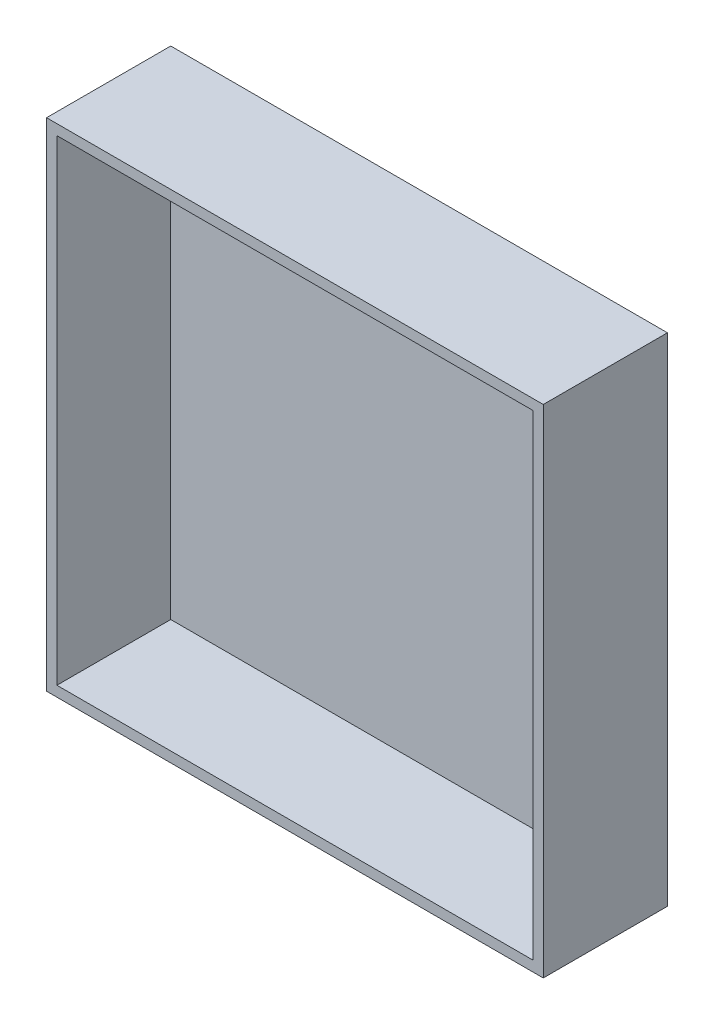
from build123d import *

# Parameters (mm, degrees)
SKETCH_1_W          = 240
SKETCH_1_H          = 240
EXTRUDE_1_DEPTH     = 60
SKETCH_2_W          = 230
SKETCH_2_H          = 230
CUT_EXTRUDE_1_DEPTH = 55


with BuildPart() as part:
    # ｽｹｯﾁ1 → ﾎﾞｽ - 押し出し1 (new body)
    with BuildSketch(Plane.XY):
        with Locations((120, -120)):
            Rectangle(SKETCH_1_W, SKETCH_1_H)
    extrude(amount=EXTRUDE_1_DEPTH)

    # ｽｹｯﾁ2 → ｶｯﾄ - 押し出し1 (cut)
    with BuildSketch(Plane.XY.offset(60)):
        with Locations((120, -120)):
            Rectangle(SKETCH_2_W, SKETCH_2_H)
    extrude(amount=-CUT_EXTRUDE_1_DEPTH, mode=Mode.SUBTRACT)


solid = part.part
